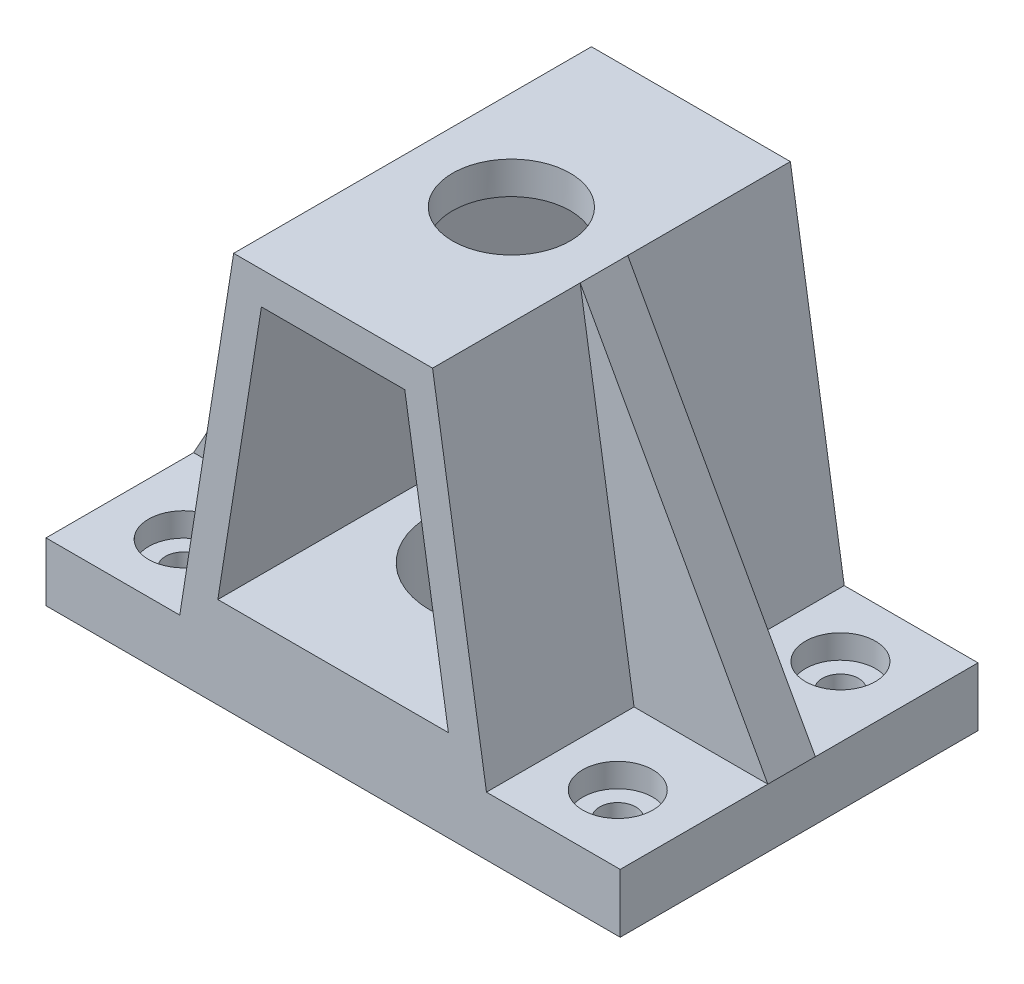
from build123d import *

# Parameters (mm, degrees)
SKETCH3_W                                           = 116.586
SKETCH3_H                                           = 72.644
BOSS_EXTRUDE1_DEPTH                                 = 5.969
BOSS_EXTRUDE2_DEPTH                                 = 36.322
BOSS_EXTRUDE3_DEPTH                                 = 9.652
CUT_EXTRUDE1_REACH                                  = 108.219
SKETCH6_R                                           = 11.938
CBORE_FOR_00_BINDING_HEAD_MACHINE_SCREW_D           = 7.366
CBORE_FOR_00_BINDING_HEAD_MACHINE_SCREW_CBORE_D     = 14.224
CBORE_FOR_00_BINDING_HEAD_MACHINE_SCREW_CBORE_DEPTH = 4.826
SKETCH9_R                                           = 16.637
CUT_EXTRUDE2_DEPTH                                  = 93.852634798


with BuildPart() as part:
    # Sketch3 → Boss-Extrude1 (new, symmetric)
    with BuildSketch(Plane(origin=(0, 0, 0), x_dir=(1, 0, 0), z_dir=(0, 1, 0))):
        Rectangle(SKETCH3_W, SKETCH3_H)
    extrude(amount=BOSS_EXTRUDE1_DEPTH, both=True)

    # Sketch4 → Boss-Extrude2 (add, symmetric)
    with BuildSketch(Plane.XY):
        Polygon((-31.135464213, 5.969), (-20.193, 75.057), (20.193, 75.057), (31.135464213, 5.969), align=None)
        Polygon((-23.403173679, 12.573), (-14.552651153, 68.453), (14.552651153, 68.453), (23.403173679, 12.573), align=None, mode=Mode.SUBTRACT)
    extrude(amount=BOSS_EXTRUDE2_DEPTH, both=True)

    # Sketch5 → Boss-Extrude3 (add)
    with BuildSketch(Plane(origin=(0, 0, -3.302), x_dir=(-1, 0, 0), z_dir=(0, 0, -1))):
        Polygon((-20.193, 75.057), (-58.293, 5.969), (-31.135464213, 5.969), align=None)
    boss_extrude3 = extrude(amount=-BOSS_EXTRUDE3_DEPTH)

    # Mirror1: Boss-Extrude3 across plane
    add(boss_extrude3.mirror(Plane(origin=(0, 0, 0), x_dir=(0, 0, 1), z_dir=(1, 0, 0))))

    # Sketch6 → Cut-Extrude1 (cut, up to next)
    with BuildSketch(Plane(origin=(0, 75.057, 0), x_dir=(1, 0, 0), z_dir=(0, 1, 0)), mode=Mode.PRIVATE) as cut_extrude1_sk1:
        with Locations(Location((-0.127, 0, 0), (0, 0, 270))):
            Circle(SKETCH6_R)
    cut_extrude1_tool1 = extrude(cut_extrude1_sk1.sketch, amount=-CUT_EXTRUDE1_REACH, mode=Mode.PRIVATE) & part.part
    add(cut_extrude1_tool1.solids().sort_by_distance((-0.127, 75.057, 0))[0], mode=Mode.SUBTRACT)

    # CBORE for #00 Binding Head Machine Screw1 (through all)
    with Locations(Plane(origin=(-44.069, 5.969, 22.5984117), x_dir=(0, 0, 1), z_dir=(0, 1, 0))):
        with Locations((0, 0), (0, 88.138), (-45.212, 88.138), (-45.212, 0)):
            CounterBoreHole(CBORE_FOR_00_BINDING_HEAD_MACHINE_SCREW_D / 2, CBORE_FOR_00_BINDING_HEAD_MACHINE_SCREW_CBORE_D / 2, CBORE_FOR_00_BINDING_HEAD_MACHINE_SCREW_CBORE_DEPTH)

    # Sketch9 → Cut-Extrude2 (cut, through all)
    with BuildSketch(Plane(origin=(0, 12.573, 0), x_dir=(1, 0, 0), z_dir=(0, 1, 0))):
        with Locations(Location((0, 0, 0), (0, 0, 270))):
            Circle(SKETCH9_R)
    extrude(amount=-CUT_EXTRUDE2_DEPTH, mode=Mode.SUBTRACT)


solid = part.part
